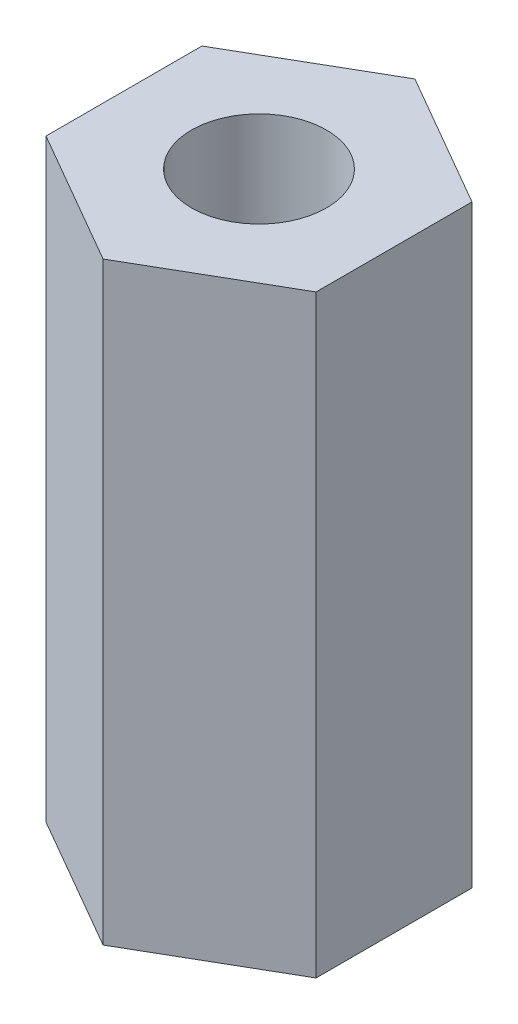
from build123d import *

# Parameters (mm, degrees)
SKETCH1_R           = 1.25
BOSS_EXTRUDE1_DEPTH = 11


with BuildPart() as part:
    # Sketch1 → Boss-Extrude1 (new body)
    with BuildSketch(Plane(origin=(0, 0, 0), x_dir=(1, 0, 0), z_dir=(0, 1, 0))):
        Polygon((0, 2.886751346), (-2.5, 1.443375673), (-2.5, -1.443375673), (0, -2.886751346), (2.5, -1.443375673), (2.5, 1.443375673), align=None)
        with Locations(Location((0, 0, 0), (0, 0, 270))):
            Circle(SKETCH1_R, mode=Mode.SUBTRACT)
    extrude(amount=BOSS_EXTRUDE1_DEPTH)


solid = part.part
